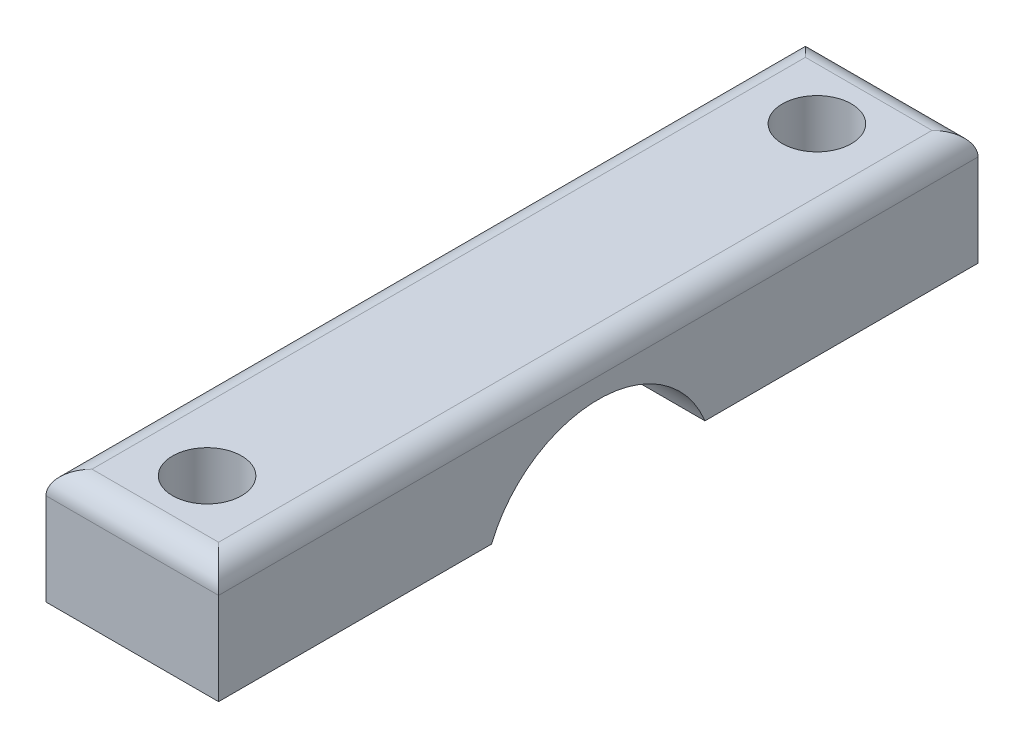
from build123d import *

# Parameters (mm, degrees)
SKETCH1_W           = 15
SKETCH1_H           = 66
SKETCH1_R           = 1.75
BOSS_EXTRUDE1_DEPTH = 10
SKETCH2_R           = 3
CUT_EXTRUDE1_DEPTH  = 6
FILLET1_R           = 2
SKETCH3_R           = 10
CUT_EXTRUDE2_DEPTH  = 15


with BuildPart() as part:
    # Sketch1 → Boss-Extrude1 (new body)
    with BuildSketch(Plane(origin=(0, 0, 0), x_dir=(1, 0, 0), z_dir=(0, 1, 0))):
        with Locations((7.5, 33)):
            Rectangle(SKETCH1_W, SKETCH1_H)
        with Locations(Location((7.5, 59.5, 0), (0, 0, 270))):
            Circle(SKETCH1_R, mode=Mode.SUBTRACT)
        with Locations(Location((7.5, 6.5, 0), (0, 0, 270))):
            Circle(SKETCH1_R, mode=Mode.SUBTRACT)
    extrude(amount=BOSS_EXTRUDE1_DEPTH)

    # Sketch2 → Cut-Extrude1 (cut)
    with BuildSketch(Plane(origin=(0, 10, 0), x_dir=(1, 0, 0), z_dir=(0, 1, 0))):
        with Locations(Location((7.5, 59.5, 0), (0, 0, 270))):
            Circle(SKETCH2_R)
        with Locations(Location((7.5, 6.5, 0), (0, 0, 270))):
            Circle(SKETCH2_R)
    extrude(amount=-CUT_EXTRUDE1_DEPTH, mode=Mode.SUBTRACT)

    # Fillet1
    fillet1_edges = [part.edges().sort_by_distance(p)[0] for p in [
        (15, 10, -33),
        (7.5, 10, -66),
        (0, 10, -33),
        (7.5, 10, 0),
    ]]
    fillet(fillet1_edges, radius=FILLET1_R)

    # Sketch3 → Cut-Extrude2 (cut)
    with BuildSketch(Plane(origin=(15, 0, 0), x_dir=(0, 0, -1), z_dir=(1, 0, 0))):
        with Locations((33, -3.75)):
            Circle(SKETCH3_R)
    extrude(amount=-CUT_EXTRUDE2_DEPTH, mode=Mode.SUBTRACT)


solid = part.part
